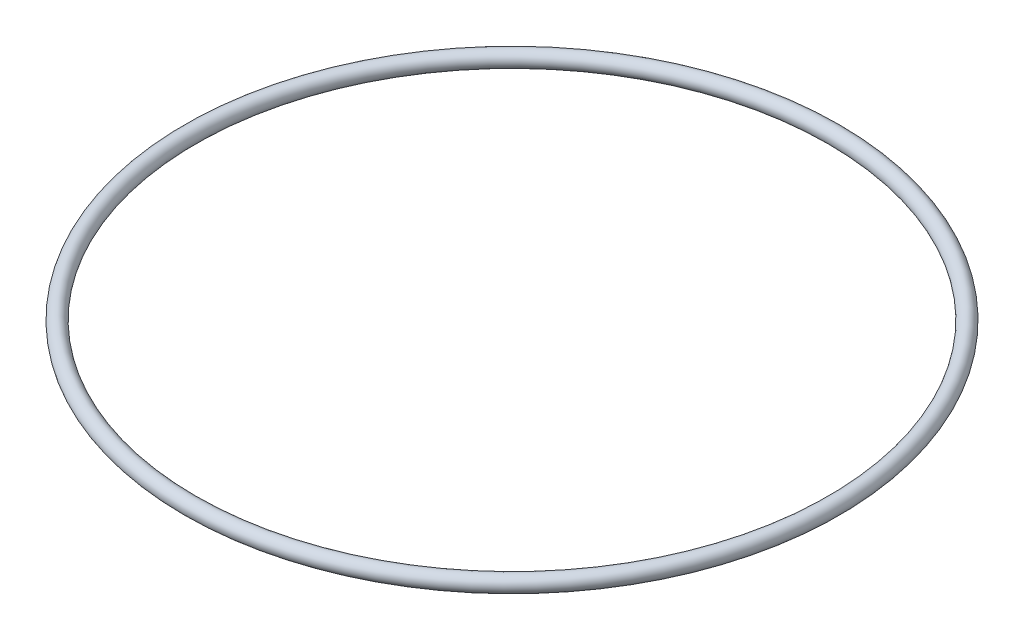
from build123d import *

# Parameters (mm, degrees)
SKETCH1_R = 1.5


with BuildPart() as part:
    # Sketch1 → Revolve1 (revolve)
    with BuildSketch(Plane.XY, mode=Mode.PRIVATE) as revolve1_sk:
        with Locations((-61.5, 0)):
            Circle(SKETCH1_R)
    revolve(revolve1_sk.sketch.rotate(Axis((0, 0, 0), (0, 1, 0)), 270), axis=Axis((0, 0, 0), (0, 1, 0)))


solid = part.part
